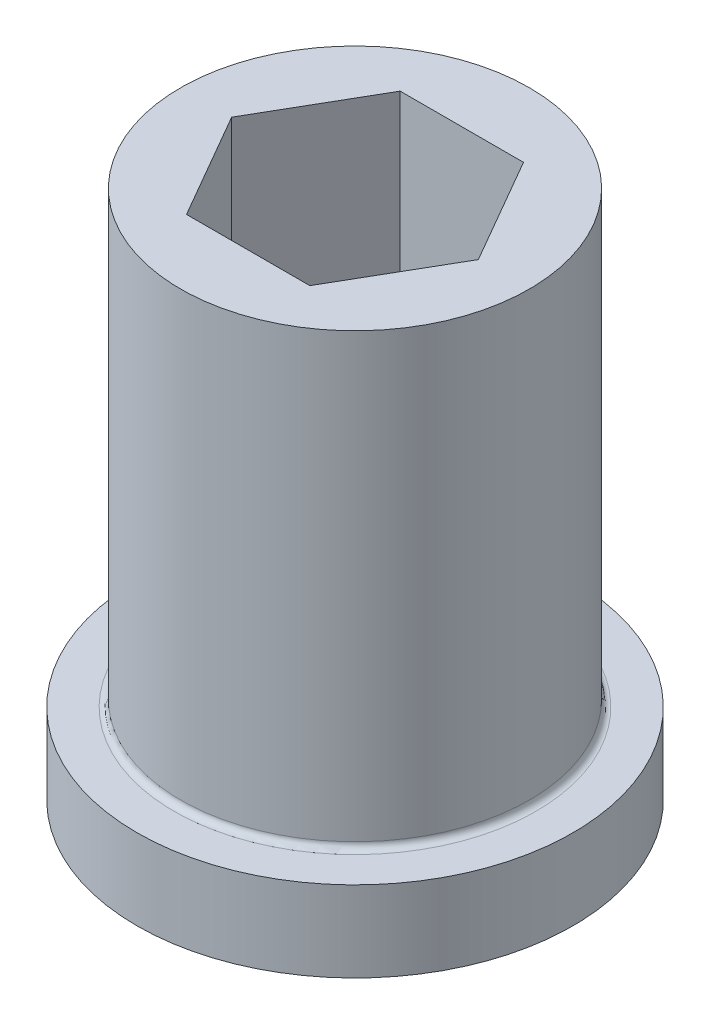
from build123d import *

# Parameters (mm, degrees)
SKETCH1_R           = 4
BOSS_EXTRUDE1_DEPTH = 10.3
SKETCH2_R           = 5
BOSS_EXTRUDE2_DEPTH = 1.85
FILLET1_R           = 0.15


with BuildPart() as part:
    # Sketch1 → Boss-Extrude1 (new body)
    with BuildSketch(Plane(origin=(0, 0, 0), x_dir=(1, 0, 0), z_dir=(0, 1, 0))):
        with Locations(Location((0, 0, 0), (0, 0, 90))):
            Circle(SKETCH1_R)
        Polygon((2.829016319, 0), (1.41450816, 2.45), (-1.41450816, 2.45), (-2.829016319, 0), (-1.41450816, -2.45), (1.41450816, -2.45), align=None, mode=Mode.SUBTRACT)
    extrude(amount=BOSS_EXTRUDE1_DEPTH)

    # Sketch2 → Boss-Extrude2 (add)
    with BuildSketch(Plane.XZ):
        with Locations(Location((0, 0, 0), (0, 0, 270))):
            Circle(SKETCH2_R)
        Polygon((2.829016319, 0), (1.41450816, 2.45), (-1.41450816, 2.45), (-2.829016319, 0), (-1.41450816, -2.45), (1.41450816, -2.45), align=None, mode=Mode.SUBTRACT)
    extrude(amount=BOSS_EXTRUDE2_DEPTH)

    # Fillet1
    fillet1_edges = [part.edges().sort_by_distance(p)[0] for p in [
        (0, 0, 4),
    ]]
    fillet(fillet1_edges, radius=FILLET1_R)


solid = part.part
